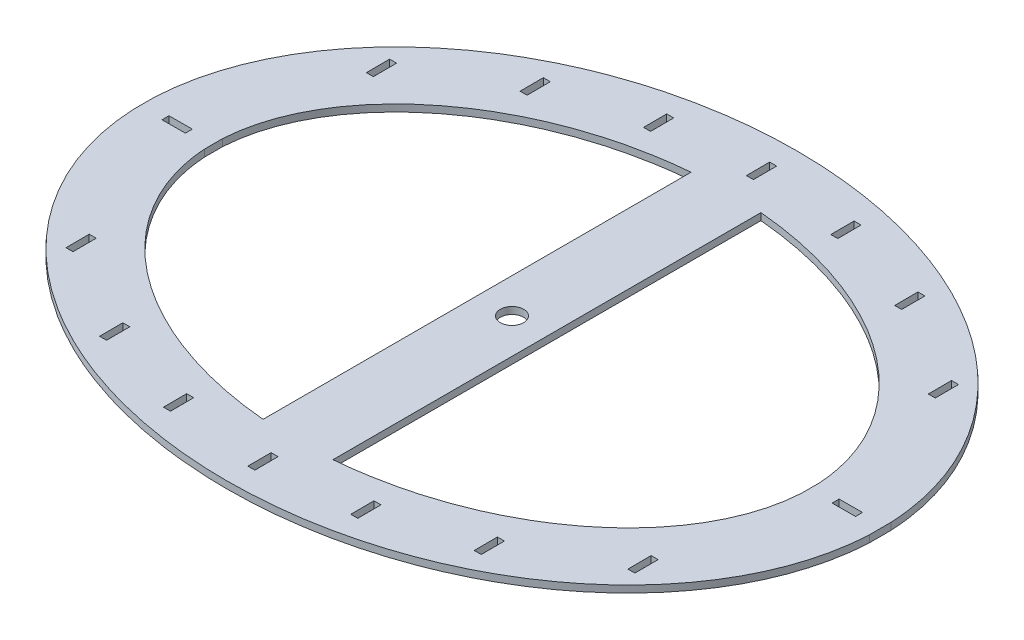
from build123d import *

# Parameters (mm, degrees)
SKETCH_2_R          = 5
EXTRUDE_1_DEPTH     = 3
CUT_EXTRUDE_1_DEPTH = 200.932491601


with BuildPart() as part:
    # 草图2 → 凸台-拉伸1 (new body)
    with BuildSketch(Plane(origin=(0, 0, 0), x_dir=(1, 0, 0), z_dir=(0, 1, 0))):
        with BuildLine():
            add(Edge.make_bspline(
                [(-158, 4.647580015), (-157.840632623, 7.898309914), (-157.230923207, 14.322386142), (-155.452746954, 23.836708418), (-151.455463066, 36.074052553), (-145.999672069, 47.671836442), (-139.230379225, 58.550935995), (-131.318807935, 68.627343709), (-120.682359228, 79.66101812), (-106.314153227, 91.393620751), (-87.729388125, 102.749099806), (-64.740966029, 112.518967886), (-39.976202938, 119.201809502), (-14.818936259, 122.590822364), (10.300366837, 122.846161773), (35.006186274, 120.076750254), (58.936571944, 114.347737623), (81.928105159, 105.552677383), (101.115324182, 94.89380247), (116.213750165, 83.595995995), (127.601010627, 72.704005397), (135.860607987, 63.075817152), (142.879120728, 52.984121912), (148.765002816, 42.186376352), (154.133853951, 28.8835882), (156.763243516, 17.891175579), (157.749742083, 9.75226901), (158, 4.647580015)],
                knots=[0, 0, 0, 0, 0, 0.030050103, 0.059543416, 0.089055708, 0.11857173, 0.148087684, 0.177604234, 0.207120827, 0.259849884, 0.318883484, 0.377917011, 0.436950613, 0.495984189, 0.552632218, 0.609280233, 0.665928258, 0.722576279, 0.779224237, 0.811190919, 0.839514883, 0.867838217, 0.896161221, 0.924483933, 0.952811697, 1, 1, 1, 1, 1], degree=4))
            Line((-158, 4.647580015), (-158, -4.647580015))
            add(Edge.make_bspline(
                [(-158, -4.647580015), (-157.840632623, -7.898309914), (-157.230923207, -14.322386142), (-155.452746954, -23.836708418), (-151.455463066, -36.074052553), (-145.999672069, -47.671836442), (-139.230379225, -58.550935995), (-131.318807935, -68.627343709), (-120.682359228, -79.66101812), (-106.314153227, -91.393620751), (-87.729388125, -102.749099806), (-64.740966029, -112.518967886), (-39.976202938, -119.201809502), (-14.818936259, -122.590822364), (10.300366837, -122.846161773), (35.006186274, -120.076750254), (58.936571944, -114.347737623), (81.928105159, -105.552677383), (101.115324182, -94.89380247), (116.213750165, -83.595995995), (127.601010627, -72.704005397), (135.860607987, -63.075817152), (142.879120728, -52.984121912), (148.765002816, -42.186376352), (154.133853951, -28.8835882), (156.763243516, -17.891175579), (157.749742083, -9.75226901), (158, -4.647580015)],
                knots=[0, 0, 0, 0, 0, 0.030050103, 0.059543416, 0.089055708, 0.11857173, 0.148087684, 0.177604234, 0.207120827, 0.259849884, 0.318883484, 0.377917011, 0.436950613, 0.495984189, 0.552632218, 0.609280233, 0.665928258, 0.722576279, 0.779224237, 0.811190919, 0.839514883, 0.867838217, 0.896161221, 0.924483933, 0.952811697, 1, 1, 1, 1, 1], degree=4))
            Line((158, -4.647580015), (158, 4.647580015))
        make_face()
        with BuildLine():
            Line((14.99999999, -91.826221469), (14.99999999, 91.826221469))
            add(Edge.make_bspline(
                [(14.99999999, 91.826221469), (25.272065208, 90.935478506), (42.978337905, 87.784663449), (66.760356672, 79.331620625), (86.250252489, 68.789883395), (103.097371825, 55.45268215), (116.36700284, 39.700766823), (123.690358435, 25.137176558), (127.017736472, 13.034900149), (127.817421208, 6.922474495), (128, 3.843082438)],
                knots=[0.540645219, 0.540645219, 0.540645219, 0.540645219, 0.624438669, 0.68665808, 0.74887749, 0.8110969, 0.873316311, 0.935535721, 0.966645426, 0.997755131, 0.997755131, 0.997755131, 0.997755131], degree=3))
            Line((128, 3.843082438), (128, -3.843082438))
            add(Edge.make_bspline(
                [(128, -3.843082438), (127.817421208, -6.922474495), (127.017736472, -13.034900149), (123.690358435, -25.137176558), (116.36700284, -39.700766823), (103.097371825, -55.45268215), (86.250252489, -68.789883395), (66.760356672, -79.331620625), (42.978337905, -87.784663449), (25.272065208, -90.935478506), (14.99999999, -91.826221469)],
                knots=[0.002244566, 0.002244566, 0.002244566, 0.002244566, 0.033354271, 0.064463976, 0.126683386, 0.188902797, 0.251122207, 0.313341617, 0.375561028, 0.459354478, 0.459354478, 0.459354478, 0.459354478], degree=3))
        make_face(mode=Mode.SUBTRACT)
        with BuildLine():
            Line((-15, 91.826204625), (-15, -91.826204624))
            add(Edge.make_bspline(
                [(-15, -91.826204624), (-25.272129397, -90.935448732), (-42.978487926, -87.784616576), (-66.760338924, -79.331638367), (-86.250604016, -68.789751516), (-103.097493512, -55.452466033), (-116.367130615, -39.700780131), (-123.690887414, -25.135387447), (-127.01753099, -13.035584443), (-127.817439146, -6.922588381), (-128, -3.843132274)],
                knots=[0.540644858, 0.540644858, 0.540644858, 0.540644858, 0.624438669, 0.68665808, 0.74887749, 0.8110969, 0.873316311, 0.935535721, 0.966645426, 0.997755131, 0.997755131, 0.997755131, 0.997755131], degree=3))
            Line((-128, -3.843132274), (-128, 3.843132274))
            add(Edge.make_bspline(
                [(-128, 3.843132274), (-127.817439146, 6.922588381), (-127.01753099, 13.035584443), (-123.690887414, 25.135387447), (-116.367130615, 39.700780131), (-103.097493512, 55.452466033), (-86.250604016, 68.789751516), (-66.760338924, 79.331638367), (-42.978487926, 87.784616576), (-25.272129397, 90.935448732), (-15, 91.826204624)],
                knots=[0.002244566, 0.002244566, 0.002244566, 0.002244566, 0.033354271, 0.064463976, 0.126683386, 0.188902797, 0.251122207, 0.313341617, 0.375561028, 0.459354839, 0.459354839, 0.459354839, 0.459354839], degree=3))
        make_face(mode=Mode.SUBTRACT)
        Circle(SKETCH_2_R, mode=Mode.SUBTRACT)
    extrude(amount=EXTRUDE_1_DEPTH)

    # 草图3 → 切除-拉伸1 (cut, through all)
    with BuildSketch(Plane(origin=(0, 3, 0), x_dir=(1, 0, 0), z_dir=(0, 1, 0))):
        Polygon((79.061701734, -95.271659003), (82.061668628, -95.257565394), (82.014689931, -85.257675744), (79.014723036, -85.271769353), align=None)
        Polygon((121.892616384, -59.179131978), (118.892649489, -59.193225587), (118.939628187, -69.193115237), (121.939595081, -69.179021627), align=None)
        Polygon((-0.858334219, -112.480728906), (2.141632676, -112.466635297), (2.094653978, -102.466745647), (-0.905312917, -102.480839257), align=None)
        Polygon((-37.87664199, -108.670646183), (-37.923620688, -98.670756533), (-40.923587583, -98.684850143), (-40.876608885, -108.684739792), align=None)
        Polygon((42.122475205, -108.294816603), (42.075496508, -98.294926953), (39.075529613, -98.309020563), (39.122508311, -108.308910212), align=None)
        Polygon((138.220248888, 2.149150661), (138.234342497, -0.850816234), (148.234232146, -0.803837537), (148.220138537, 2.196129358), align=None)
        Polygon((121.284233788, 70.321240537), (118.284266893, 70.307146928), (118.33124559, 60.307257278), (121.331212485, 60.321350887), align=None)
        Polygon((78.16307615, 96.009861114), (78.210054848, 86.009971464), (81.210021742, 86.024065074), (81.163043045, 96.023954723), align=None)
        Polygon((38.103152377, 108.671282743), (38.150131075, 98.671393094), (41.150097969, 98.685486703), (41.103119272, 108.685376352), align=None)
        Polygon((-1.868143592, 102.467382207), (1.131823303, 102.481475817), (1.084844606, 112.481365466), (-1.915122289, 112.467271857), align=None)
        Polygon((-41.895964819, 108.295453163), (-41.848986121, 98.295563514), (-38.849019226, 98.309657123), (-38.895997924, 108.309546772), align=None)
        Polygon((-81.835158242, 95.258201954), (-81.788179544, 85.258312304), (-78.788212649, 85.272405914), (-78.835191347, 95.272295563), align=None)
        Polygon((-118.7131178, 69.193751797), (-121.713084695, 69.179658188), (-121.666105997, 59.179768538), (-118.666139102, 59.193862147), align=None)
        Polygon((-148.00772176, 0.804474097), (-147.993628151, -2.195492798), (-137.993738501, -2.1485141), (-138.00783211, 0.851452795), align=None)
        Polygon((-118.104735204, -60.306620718), (-121.104702099, -60.320714327), (-121.057723401, -70.320603977), (-118.057756506, -70.306510367), align=None)
        Polygon((-80.936532658, -96.023318163), (-77.936565763, -96.009224554), (-77.983544461, -86.009334904), (-80.983511356, -86.023428513), align=None)
    extrude(amount=-CUT_EXTRUDE_1_DEPTH, mode=Mode.SUBTRACT)


solid = part.part
